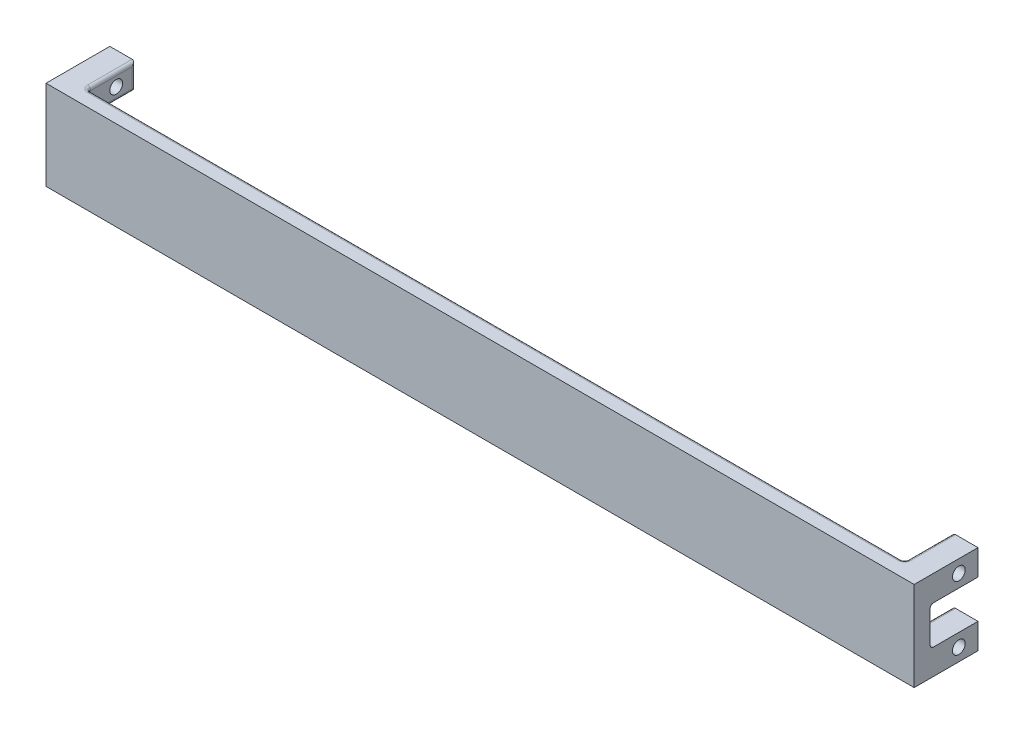
from build123d import *

# Parameters (mm, degrees)
SKETCH1_W               = 272
SKETCH1_H               = 5
BOSS_EXTRUDE1_DEPTH     = 28
SKETCH2_W               = 8
SKETCH2_H               = 28
BOSS_EXTRUDE2_DEPTH     = 15
CUT_EXTRUDE1_DEPTH      = 274.996806551
CUT_EXTRUDE1_DEPTH_BACK = 274.996806551
SKETCH3_W               = 15
SKETCH3_H               = 12
FILLET1_R               = 1
CUT_EXTRUDE2_DEPTH      = 274.996806551
CUT_EXTRUDE2_DEPTH_BACK = 274.996806551
SKETCH4_R               = 2


with BuildPart() as part:
    # Sketch1 → Boss-Extrude1 (new body)
    with BuildSketch(Plane(origin=(0, 0, 0), x_dir=(1, 0, 0), z_dir=(0, 1, 0))):
        Rectangle(SKETCH1_W, SKETCH1_H)
    extrude(amount=BOSS_EXTRUDE1_DEPTH)

    # Sketch2 → Boss-Extrude2 (add)
    with BuildSketch(Plane(origin=(0, 0, -2.5), x_dir=(-1, 0, 0), z_dir=(0, 0, -1))):
        with Locations((-132, 14)):
            Rectangle(SKETCH2_W, SKETCH2_H)
        with Locations((132, 14)):
            Rectangle(SKETCH2_W, SKETCH2_H)
    extrude(amount=BOSS_EXTRUDE2_DEPTH)

    # Sketch3 → Cut-Extrude1 (cut, two sides: drawn at the far end of the back side and taken through both)
    with BuildSketch(Plane(origin=(136, 0, 0), x_dir=(0, 0, -1), z_dir=(1, 0, 0)).offset(-CUT_EXTRUDE1_DEPTH_BACK)):
        with Locations((10, 14)):
            Rectangle(SKETCH3_W, SKETCH3_H)
    extrude(amount=CUT_EXTRUDE1_DEPTH + CUT_EXTRUDE1_DEPTH_BACK, mode=Mode.SUBTRACT)

    # Fillet1
    fillet1_edges = [part.edges().sort_by_distance(p)[0] for p in [
        (0, 0, -2.5),
        (0, 28, -2.5),
        (128, 4, -2.5),
        (128, 0, -10),
        (128, 28, -10),
        (128, 4, -17.5),
        (-128, 24, -2.5),
        (-128, 28, -10),
        (-128, 0, -10),
        (-128, 24, -17.5),
        (-128, 4, -17.5),
        (-128, 4, -2.5),
        (128, 24, -17.5),
        (128, 24, -2.5),
        (132, 8, -2.5),
        (-132, 8, -2.5),
        (132, 20, -2.5),
        (-132, 20, -2.5),
        (128, 8, -10),
        (-128, 8, -10),
        (128, 20, -10),
        (-128, 20, -10),
    ]]
    fillet(fillet1_edges, radius=FILLET1_R)

    # Sketch4 → Cut-Extrude2 (cut, two sides: drawn at the far end of the back side and taken through both)
    with BuildSketch(Plane(origin=(136, 0, 0), x_dir=(0, 0, -1), z_dir=(1, 0, 0)).offset(-CUT_EXTRUDE2_DEPTH_BACK)):
        with Locations((11.5, 24)):
            Circle(SKETCH4_R)
        with Locations((11.5, 4)):
            Circle(SKETCH4_R)
    extrude(amount=CUT_EXTRUDE2_DEPTH + CUT_EXTRUDE2_DEPTH_BACK, mode=Mode.SUBTRACT)


solid = part.part
